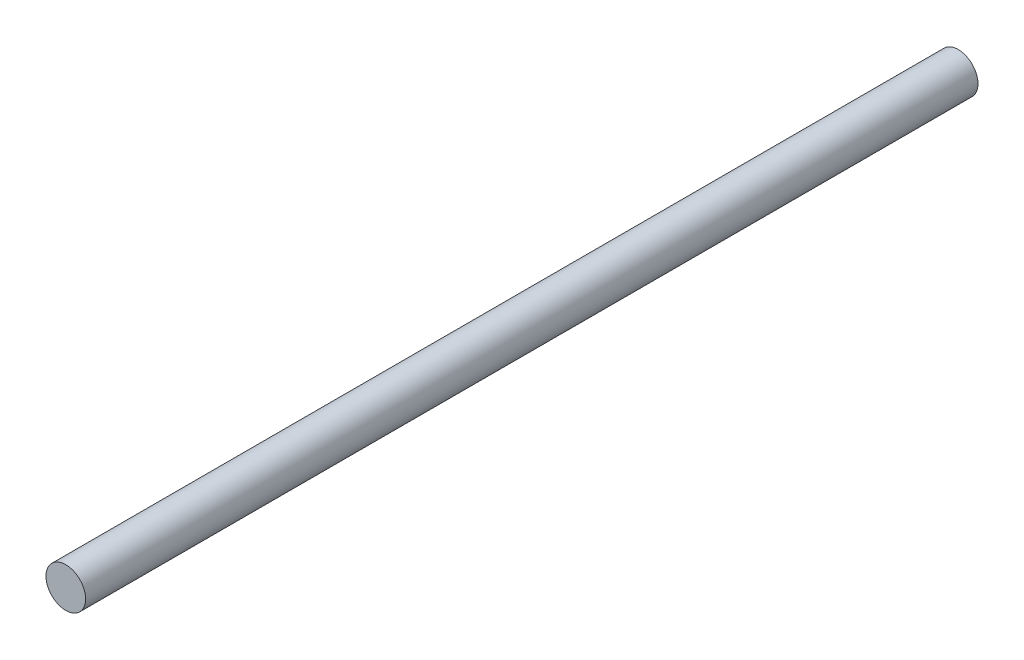
from build123d import *

# Parameters (mm, degrees)
SKETCH_1_R      = 10
EXTRUDE_1_DEPTH = 450


with BuildPart() as part:
    # Эскиз1 → Вытянуть1 (new body)
    with BuildSketch(Plane.XY):
        Circle(SKETCH_1_R)
    extrude(amount=EXTRUDE_1_DEPTH)


solid = part.part
